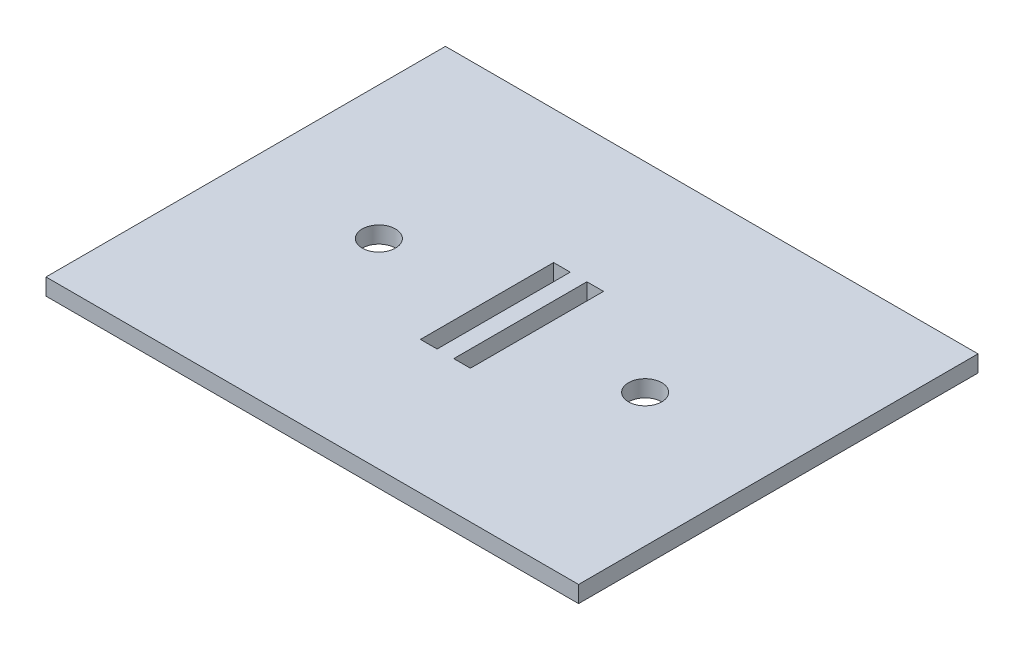
from build123d import *

# Parameters (mm, degrees)
SKETCH2_W           = 101.6
SKETCH2_H           = 76.2
SKETCH2_R           = 3.175
SKETCH2_W_2         = 3.175
SKETCH2_H_2         = 25.4
BOSS_EXTRUDE1_DEPTH = 3.175


with BuildPart() as part:
    # Sketch2 → Boss-Extrude1 (new body)
    with BuildSketch(Plane(origin=(0, 0, 0), x_dir=(1, 0, 0), z_dir=(0, 1, 0))):
        Rectangle(SKETCH2_W, SKETCH2_H)
        with Locations(Location((25.4, 0, 0), (0, 0, 270))):
            Circle(SKETCH2_R, mode=Mode.SUBTRACT)
        with Locations(Location((-25.4, 0, 0), (0, 0, 270))):
            Circle(SKETCH2_R, mode=Mode.SUBTRACT)
        with Locations((3.175, 0)):
            Rectangle(SKETCH2_W_2, SKETCH2_H_2, mode=Mode.SUBTRACT)
        with Locations((-3.175, 0)):
            Rectangle(SKETCH2_W_2, SKETCH2_H_2, mode=Mode.SUBTRACT)
    extrude(amount=BOSS_EXTRUDE1_DEPTH)


solid = part.part
